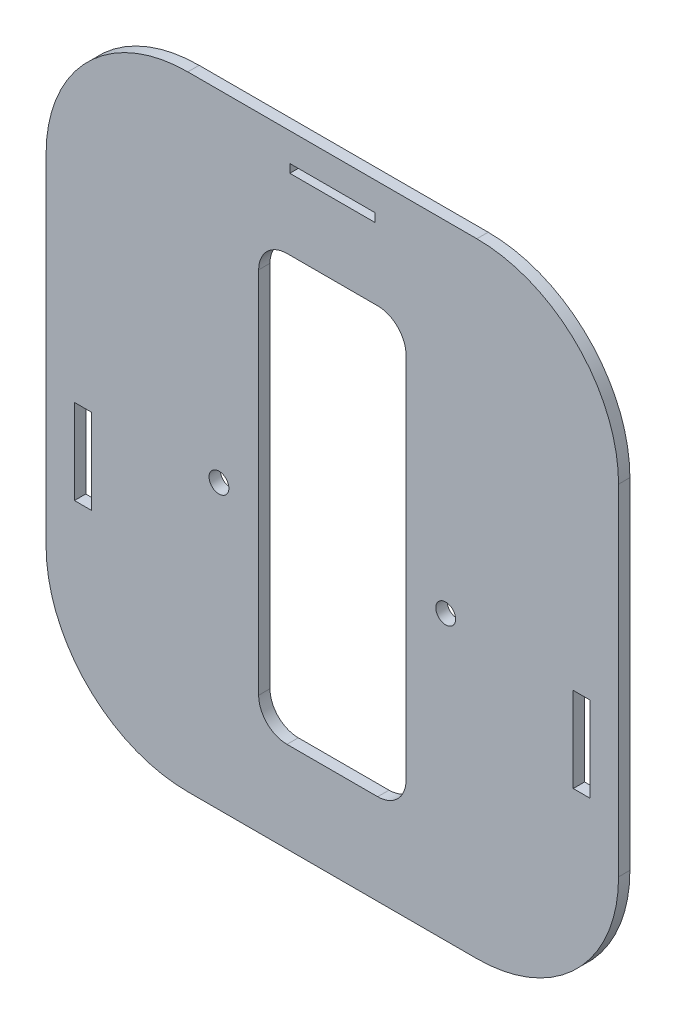
from build123d import *

# Parameters (mm, degrees)
SKETCH1_W           = 101
SKETCH1_H           = 110
BOSS_EXTRUDE1_DEPTH = 2
SKETCH3_W           = 15
SKETCH3_H           = 1.5
SKETCH3_W_2         = 3
SKETCH3_H_2         = 15
CUT_EXTRUDE1_DEPTH  = 128.433943673
FILLET2_R           = 25
SKETCH9_W           = 26
SKETCH9_H           = 75
CUT_EXTRUDE2_DEPTH  = 128.433943673
FILLET3_R           = 5
SKETCH4_R           = 1.75
CUT_EXTRUDE3_DEPTH  = 10


with BuildPart() as part:
    # Sketch1 → Boss-Extrude1 (new body)
    with BuildSketch(Plane.XY):
        with Locations((42.5, 32.1)):
            Rectangle(SKETCH1_W, SKETCH1_H)
    extrude(amount=BOSS_EXTRUDE1_DEPTH)

    # Sketch3 → Cut-Extrude1 (cut, through all)
    with BuildSketch(Plane.XY.offset(2)):
        with Locations((42.5, 81.35)):
            Rectangle(SKETCH3_W, SKETCH3_H)
        with Locations((-1.5, 19.1)):
            Rectangle(SKETCH3_W_2, SKETCH3_H_2)
        with Locations((86.5, 19.1)):
            Rectangle(SKETCH3_W_2, SKETCH3_H_2)
    extrude(amount=-CUT_EXTRUDE1_DEPTH, mode=Mode.SUBTRACT)

    # Fillet2
    fillet2_edges = [part.edges().sort_by_distance(p)[0] for p in [
        (-8, 87.1, 1),
        (93, 87.1, 1),
        (93, -22.9, 1),
        (-8, -22.9, 1),
    ]]
    fillet(fillet2_edges, radius=FILLET2_R)

    # Sketch9 → Cut-Extrude2 (cut, through all)
    with BuildSketch(Plane.XY.offset(2)):
        with Locations((42.5, 30.6)):
            Rectangle(SKETCH9_W, SKETCH9_H)
    extrude(amount=-CUT_EXTRUDE2_DEPTH, mode=Mode.SUBTRACT)

    # Fillet3
    fillet3_edges = [part.edges().sort_by_distance(p)[0] for p in [
        (29.5, -6.9, 1),
        (29.5, 68.1, 1),
        (55.5, 68.1, 1),
        (55.5, -6.9, 1),
    ]]
    fillet(fillet3_edges, radius=FILLET3_R)

    # Sketch4 → Cut-Extrude3 (cut)
    with BuildSketch(Plane.XY.offset(2)):
        with Locations((22.5, 27.1)):
            Circle(SKETCH4_R)
        with Locations((62.5, 27.1)):
            Circle(SKETCH4_R)
    extrude(amount=-CUT_EXTRUDE3_DEPTH, mode=Mode.SUBTRACT)


solid = part.part
